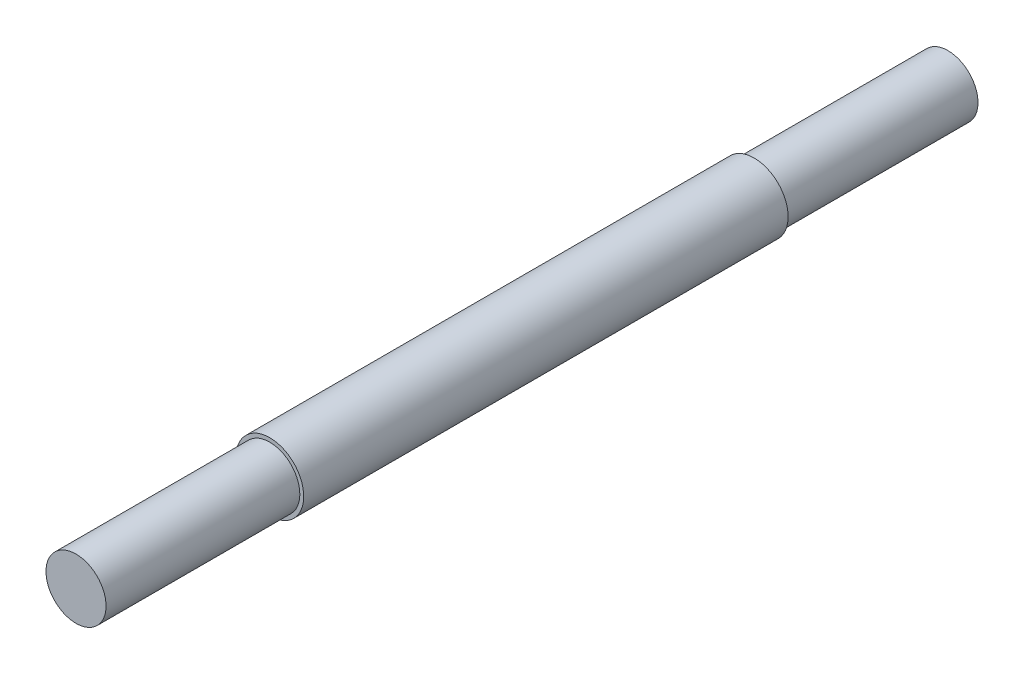
from build123d import *


with BuildPart() as part:
    # Sketch1 → Revolve1 (revolve)
    with BuildSketch(Plane(origin=(0, 0, 0), x_dir=(0, 0, -1), z_dir=(1, 0, 0))):
        Polygon((0, 0), (-22.5, 0), (-22.5, 1.55), (-12.5, 1.55), (-12.5, 1.75), (12.5, 1.75), (12.5, 1.55), (22.5, 1.55), (22.5, 0), align=None)
    revolve(axis=Axis((0, 0, 0), (0, 0, 1)))


solid = part.part
